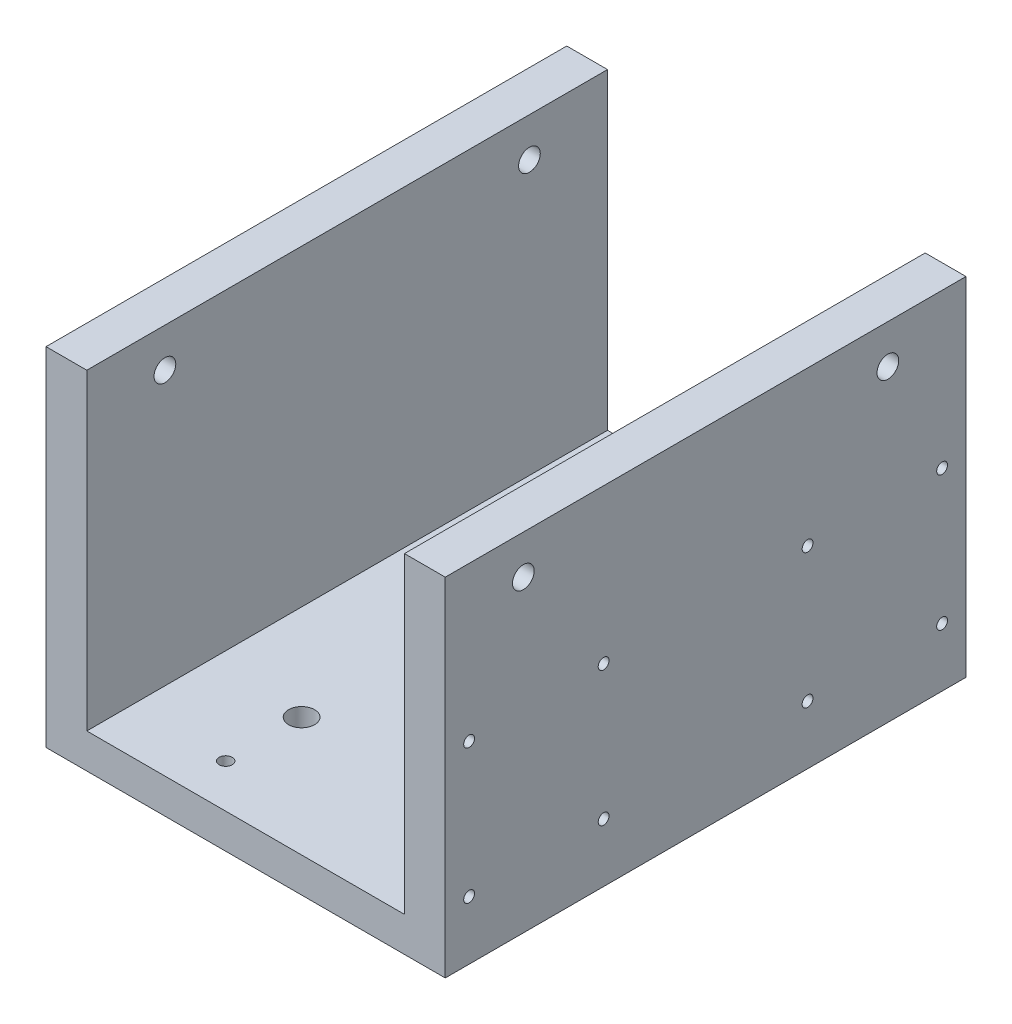
from build123d import *

# Parameters (mm, degrees)
SKETCH1_W           = 92
SKETCH1_H           = 120
BOSS_EXTRUDE1_DEPTH = 8
SKETCH2_W           = 9.4
SKETCH2_H           = 120
BOSS_EXTRUDE2_DEPTH = 72
CUT_EXTRUDE1_REACH  = 173.067
SKETCH3_R           = 3
SKETCH3_R_2         = 1.5
CUT_EXTRUDE2_REACH  = 173.067
SKETCH4_R           = 1.25
SKETCH5_R           = 2.5
CUT_EXTRUDE3_DEPTH  = 172.067238243


with BuildPart() as part:
    # Sketch1 → Boss-Extrude1 (new body)
    with BuildSketch(Plane(origin=(0, 0, 0), x_dir=(1, 0, 0), z_dir=(0, 1, 0))):
        with Locations((46, 60)):
            Rectangle(SKETCH1_W, SKETCH1_H)
    extrude(amount=BOSS_EXTRUDE1_DEPTH)

    # Sketch2 → Boss-Extrude2 (add)
    with BuildSketch(Plane(origin=(0, 8, 0), x_dir=(1, 0, 0), z_dir=(0, 1, 0))):
        with Locations((4.7, 60)):
            Rectangle(SKETCH2_W, SKETCH2_H)
        with Locations((87.3, 60)):
            Rectangle(SKETCH2_W, SKETCH2_H)
    extrude(amount=BOSS_EXTRUDE2_DEPTH)

    # Sketch3 → Cut-Extrude1 (cut, up to next)
    with BuildSketch(Plane.XZ, mode=Mode.PRIVATE) as cut_extrude1_sk1:
        with Locations(Location((31.4, -92.5, 0), (0, 0, 270))):
            Circle(SKETCH3_R)
    cut_extrude1_tool1 = extrude(cut_extrude1_sk1.sketch, amount=-CUT_EXTRUDE1_REACH, mode=Mode.PRIVATE) & part.part
    # Sketch3 → Cut-Extrude1 (cut, up to next)
    with BuildSketch(Plane.XZ, mode=Mode.PRIVATE) as cut_extrude1_sk2:
        with Locations(Location((31.4, -110, 0), (0, 0, 270))):
            Circle(SKETCH3_R_2)
    cut_extrude1_tool2 = extrude(cut_extrude1_sk2.sketch, amount=-CUT_EXTRUDE1_REACH, mode=Mode.PRIVATE) & part.part
    # Sketch3 → Cut-Extrude1 (cut, up to next)
    with BuildSketch(Plane.XZ, mode=Mode.PRIVATE) as cut_extrude1_sk3:
        with Locations(Location((31.4, -10, 0), (0, 0, 270))):
            Circle(SKETCH3_R_2)
    cut_extrude1_tool3 = extrude(cut_extrude1_sk3.sketch, amount=-CUT_EXTRUDE1_REACH, mode=Mode.PRIVATE) & part.part
    # Sketch3 → Cut-Extrude1 (cut, up to next)
    with BuildSketch(Plane.XZ, mode=Mode.PRIVATE) as cut_extrude1_sk4:
        with Locations(Location((31.4, -27.5, 0), (0, 0, 270))):
            Circle(SKETCH3_R)
    cut_extrude1_tool4 = extrude(cut_extrude1_sk4.sketch, amount=-CUT_EXTRUDE1_REACH, mode=Mode.PRIVATE) & part.part
    add(cut_extrude1_tool1.solids().sort_by_distance((31.4, 0, -92.5))[0], mode=Mode.SUBTRACT)
    add(cut_extrude1_tool2.solids().sort_by_distance((31.4, 0, -110))[0], mode=Mode.SUBTRACT)
    add(cut_extrude1_tool3.solids().sort_by_distance((31.4, 0, -10))[0], mode=Mode.SUBTRACT)
    add(cut_extrude1_tool4.solids().sort_by_distance((31.4, 0, -27.5))[0], mode=Mode.SUBTRACT)

    # Sketch4 → Cut-Extrude2 (cut, up to next)
    with BuildSketch(Plane(origin=(92, 0, 0), x_dir=(0, 0, -1), z_dir=(1, 0, 0)), mode=Mode.PRIVATE) as cut_extrude2_sk1:
        with Locations((5.5, 44.5)):
            Circle(SKETCH4_R)
    cut_extrude2_tool1 = extrude(cut_extrude2_sk1.sketch, amount=-CUT_EXTRUDE2_REACH, mode=Mode.PRIVATE) & part.part
    # Sketch4 → Cut-Extrude2 (cut, up to next)
    with BuildSketch(Plane(origin=(92, 0, 0), x_dir=(0, 0, -1), z_dir=(1, 0, 0)), mode=Mode.PRIVATE) as cut_extrude2_sk2:
        with Locations((36.5, 44.5)):
            Circle(SKETCH4_R)
    cut_extrude2_tool2 = extrude(cut_extrude2_sk2.sketch, amount=-CUT_EXTRUDE2_REACH, mode=Mode.PRIVATE) & part.part
    # Sketch4 → Cut-Extrude2 (cut, up to next)
    with BuildSketch(Plane(origin=(92, 0, 0), x_dir=(0, 0, -1), z_dir=(1, 0, 0)), mode=Mode.PRIVATE) as cut_extrude2_sk3:
        with Locations((5.5, 13.5)):
            Circle(SKETCH4_R)
    cut_extrude2_tool3 = extrude(cut_extrude2_sk3.sketch, amount=-CUT_EXTRUDE2_REACH, mode=Mode.PRIVATE) & part.part
    # Sketch4 → Cut-Extrude2 (cut, up to next)
    with BuildSketch(Plane(origin=(92, 0, 0), x_dir=(0, 0, -1), z_dir=(1, 0, 0)), mode=Mode.PRIVATE) as cut_extrude2_sk4:
        with Locations((36.5, 13.5)):
            Circle(SKETCH4_R)
    cut_extrude2_tool4 = extrude(cut_extrude2_sk4.sketch, amount=-CUT_EXTRUDE2_REACH, mode=Mode.PRIVATE) & part.part
    # Sketch4 → Cut-Extrude2 (cut, up to next)
    with BuildSketch(Plane(origin=(92, 0, 0), x_dir=(0, 0, -1), z_dir=(1, 0, 0)), mode=Mode.PRIVATE) as cut_extrude2_sk5:
        with Locations((83.5, 13.5)):
            Circle(SKETCH4_R)
    cut_extrude2_tool5 = extrude(cut_extrude2_sk5.sketch, amount=-CUT_EXTRUDE2_REACH, mode=Mode.PRIVATE) & part.part
    # Sketch4 → Cut-Extrude2 (cut, up to next)
    with BuildSketch(Plane(origin=(92, 0, 0), x_dir=(0, 0, -1), z_dir=(1, 0, 0)), mode=Mode.PRIVATE) as cut_extrude2_sk6:
        with Locations((114.5, 13.5)):
            Circle(SKETCH4_R)
    cut_extrude2_tool6 = extrude(cut_extrude2_sk6.sketch, amount=-CUT_EXTRUDE2_REACH, mode=Mode.PRIVATE) & part.part
    # Sketch4 → Cut-Extrude2 (cut, up to next)
    with BuildSketch(Plane(origin=(92, 0, 0), x_dir=(0, 0, -1), z_dir=(1, 0, 0)), mode=Mode.PRIVATE) as cut_extrude2_sk7:
        with Locations((83.5, 44.5)):
            Circle(SKETCH4_R)
    cut_extrude2_tool7 = extrude(cut_extrude2_sk7.sketch, amount=-CUT_EXTRUDE2_REACH, mode=Mode.PRIVATE) & part.part
    # Sketch4 → Cut-Extrude2 (cut, up to next)
    with BuildSketch(Plane(origin=(92, 0, 0), x_dir=(0, 0, -1), z_dir=(1, 0, 0)), mode=Mode.PRIVATE) as cut_extrude2_sk8:
        with Locations((114.5, 44.5)):
            Circle(SKETCH4_R)
    cut_extrude2_tool8 = extrude(cut_extrude2_sk8.sketch, amount=-CUT_EXTRUDE2_REACH, mode=Mode.PRIVATE) & part.part
    add(cut_extrude2_tool1.solids().sort_by_distance((92, 44.5, -5.5))[0], mode=Mode.SUBTRACT)
    add(cut_extrude2_tool2.solids().sort_by_distance((92, 44.5, -36.5))[0], mode=Mode.SUBTRACT)
    add(cut_extrude2_tool3.solids().sort_by_distance((92, 13.5, -5.5))[0], mode=Mode.SUBTRACT)
    add(cut_extrude2_tool4.solids().sort_by_distance((92, 13.5, -36.5))[0], mode=Mode.SUBTRACT)
    add(cut_extrude2_tool5.solids().sort_by_distance((92, 13.5, -83.5))[0], mode=Mode.SUBTRACT)
    add(cut_extrude2_tool6.solids().sort_by_distance((92, 13.5, -114.5))[0], mode=Mode.SUBTRACT)
    add(cut_extrude2_tool7.solids().sort_by_distance((92, 44.5, -83.5))[0], mode=Mode.SUBTRACT)
    add(cut_extrude2_tool8.solids().sort_by_distance((92, 44.5, -114.5))[0], mode=Mode.SUBTRACT)

    # Sketch5 → Cut-Extrude3 (cut, through all)
    with BuildSketch(Plane(origin=(92, 0, 0), x_dir=(0, 0, -1), z_dir=(1, 0, 0))):
        with Locations((18, 71)):
            Circle(SKETCH5_R)
        with Locations((102, 71)):
            Circle(SKETCH5_R)
    extrude(amount=-CUT_EXTRUDE3_DEPTH, mode=Mode.SUBTRACT)


solid = part.part
